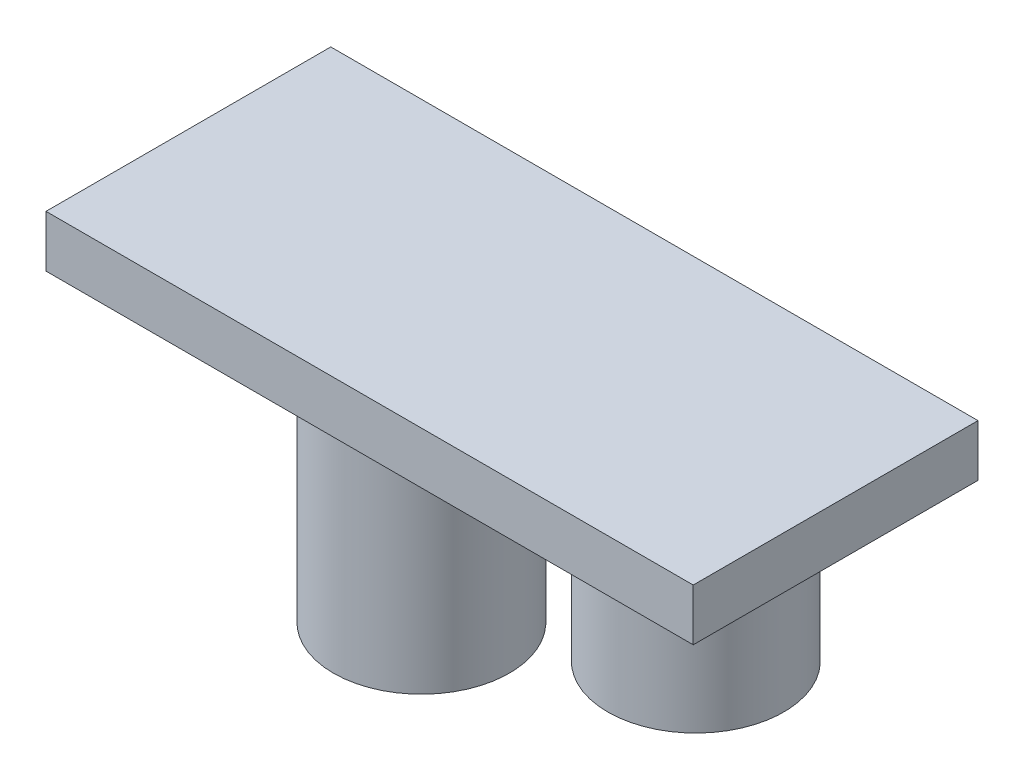
from build123d import *

# Parameters (mm, degrees)
SKETCH_2_R      = 1.7
EXTRUDE_1_DEPTH = 5
SKETCH_9_W      = 12.5
SKETCH_9_H      = 5.5
EXTRUDE_5_DEPTH = 1
SKETCH_11_R     = 1.7
EXTRUDE_6_DEPTH = 3


with BuildPart() as part:
    # 草图2 → 凸台-拉伸1 (new body)
    with BuildSketch(Plane(origin=(0, 0, 0), x_dir=(1, 0, 0), z_dir=(0, 1, 0))):
        with Locations(Location((0, 0, 0), (0, 0, 270))):
            Circle(SKETCH_2_R)
    extrude(amount=-EXTRUDE_1_DEPTH)

    # 草图9 → 凸台-拉伸5 (add)
    with BuildSketch(Plane(origin=(0, 0, 0), x_dir=(1, 0, 0), z_dir=(0, 1, 0))):
        with Locations((1.75, 0)):
            Rectangle(SKETCH_9_W, SKETCH_9_H)
    extrude(amount=EXTRUDE_5_DEPTH)

    # 草图11 → 凸台-拉伸6 (add)
    with BuildSketch(Plane.XZ):
        with Locations(Location((5.3, 0, 0), (0, 0, 270))):
            Circle(SKETCH_11_R)
    extrude(amount=EXTRUDE_6_DEPTH)


solid = part.part
